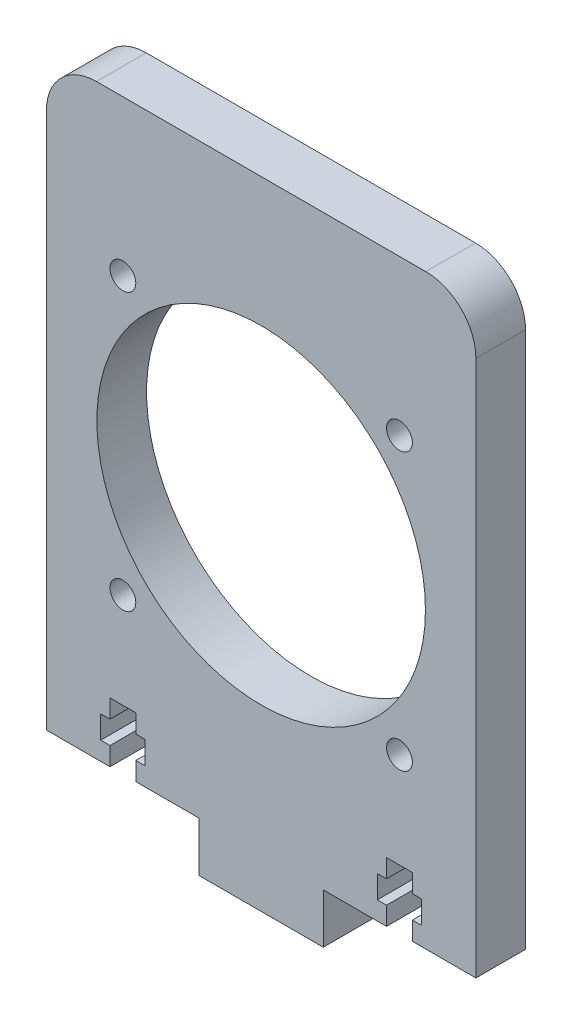
from build123d import *

# Parameters (mm, degrees)
SKETCH1_W           = 109.8
SKETCH1_H           = 150
SKETCH1_R           = 42
SKETCH1_R_2         = 3.3
BOSS_EXTRUDE1_DEPTH = 12.7
CUT_EXTRUDE1_DEPTH  = 94.809914188
BOSS_EXTRUDE2_DEPTH = 12.7
FILLET1_R           = 12.8


with BuildPart() as part:
    # Sketch1 → Boss-Extrude1 (new body)
    with BuildSketch(Plane.XY):
        Rectangle(SKETCH1_W, SKETCH1_H)
        Circle(SKETCH1_R, mode=Mode.SUBTRACT)
        with Locations((-35.355339059, 35.355339059)):
            Circle(SKETCH1_R_2, mode=Mode.SUBTRACT)
        with Locations((35.355339059, 35.355339059)):
            Circle(SKETCH1_R_2, mode=Mode.SUBTRACT)
        with Locations((35.355339059, -35.355339059)):
            Circle(SKETCH1_R_2, mode=Mode.SUBTRACT)
        with Locations((-35.355339059, -35.355339059)):
            Circle(SKETCH1_R_2, mode=Mode.SUBTRACT)
    extrude(amount=BOSS_EXTRUDE1_DEPTH)

    # Sketch2 → Cut-Extrude1 (cut, through all)
    with BuildSketch(Plane(origin=(0, 0, 0), x_dir=(-1, 0, 0), z_dir=(0, 0, -1))):
        Polygon((-38.65, -75), (-32.05, -75), (-32.05, -70.3), (-29.686, -70.3), (-29.686, -64.46), (-32.05, -64.46), (-32.05, -59.76), (-38.65, -59.76), (-38.65, -64.46), (-41.014, -64.46), (-41.014, -70.3), (-38.65, -70.3), align=None)
        Polygon((32.05, -75), (32.05, -70.3), (29.686, -70.3), (29.686, -64.46), (32.05, -64.46), (32.05, -59.76), (38.65, -59.76), (38.65, -64.46), (41.014, -64.46), (41.014, -70.3), (38.65, -70.3), (38.65, -75), align=None)
    extrude(amount=-CUT_EXTRUDE1_DEPTH, mode=Mode.SUBTRACT)

    # Sketch4 → Boss-Extrude2 (add)
    with BuildSketch(Plane.XZ.offset(75)):
        Polygon((0, 0), (15.875, 0), (15.875, 12.7), (-15.875, 12.7), (-15.875, 0), align=None)
    extrude(amount=BOSS_EXTRUDE2_DEPTH)

    # Fillet1
    fillet1_edges = [part.edges().sort_by_distance(p)[0] for p in [
        (-54.9, 75, 6.35),
        (54.9, 75, 6.35),
    ]]
    fillet(fillet1_edges, radius=FILLET1_R)


solid = part.part
